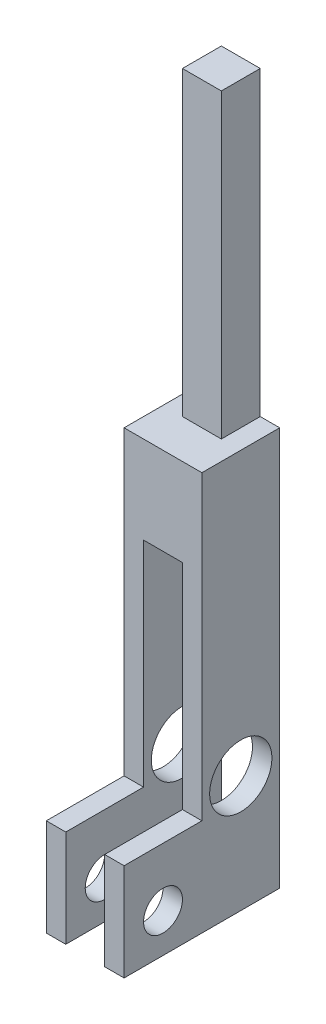
from build123d import *

# Parameters (mm, degrees)
SKETCH1_W           = 20
SKETCH1_H           = 40
BOSS_EXTRUDE1_DEPTH = 180
SKETCH2_W           = 20
SKETCH2_H           = 155
CUT_EXTRUDE1_DEPTH  = 29
SKETCH3_W           = 10
SKETCH3_H           = 77.5
CUT_EXTRUDE2_DEPTH  = 29
SKETCH4_W           = 10
SKETCH4_H           = 80
CUT_EXTRUDE3_DEPTH  = 49
SKETCH5_W           = 5
SKETCH5_H           = 77.5
CUT_EXTRUDE4_DEPTH  = 49
SKETCH6_W           = 5
SKETCH6_H           = 77.5
CUT_EXTRUDE5_DEPTH  = 49
SKETCH7_R           = 5
CUT_EXTRUDE6_DEPTH  = 49
SKETCH8_R           = 8
CUT_EXTRUDE7_DEPTH  = 49


with BuildPart() as part:
    # Sketch1 → Boss-Extrude1 (new body)
    with BuildSketch(Plane(origin=(0, 0, 0), x_dir=(1, 0, 0), z_dir=(0, 1, 0))):
        with Locations((10, 20)):
            Rectangle(SKETCH1_W, SKETCH1_H)
    extrude(amount=BOSS_EXTRUDE1_DEPTH)

    # Sketch2 → Cut-Extrude1 (cut)
    with BuildSketch(Plane.ZY):
        with Locations((-10, 102.5)):
            Rectangle(SKETCH2_W, SKETCH2_H)
    extrude(amount=-CUT_EXTRUDE1_DEPTH, mode=Mode.SUBTRACT)

    # Sketch3 → Cut-Extrude2 (cut)
    with BuildSketch(Plane.ZY):
        with Locations((-25, 141.25)):
            Rectangle(SKETCH3_W, SKETCH3_H)
    extrude(amount=-CUT_EXTRUDE2_DEPTH, mode=Mode.SUBTRACT)

    # Sketch4 → Cut-Extrude3 (cut)
    with BuildSketch(Plane(origin=(0, 0, -40), x_dir=(-1, 0, 0), z_dir=(0, 0, -1))):
        with Locations((-10, 40)):
            Rectangle(SKETCH4_W, SKETCH4_H)
    extrude(amount=-CUT_EXTRUDE3_DEPTH, mode=Mode.SUBTRACT)

    # Sketch5 → Cut-Extrude4 (cut)
    with BuildSketch(Plane.XY.offset(-30)):
        with Locations((2.5, 141.25)):
            Rectangle(SKETCH5_W, SKETCH5_H)
    extrude(amount=-CUT_EXTRUDE4_DEPTH, mode=Mode.SUBTRACT)

    # Sketch6 → Cut-Extrude5 (cut)
    with BuildSketch(Plane.XY.offset(-30)):
        with Locations((17.5, 141.25)):
            Rectangle(SKETCH6_W, SKETCH6_H)
    extrude(amount=-CUT_EXTRUDE5_DEPTH, mode=Mode.SUBTRACT)

    # Sketch7 → Cut-Extrude6 (cut)
    with BuildSketch(Plane(origin=(20, 0, 0), x_dir=(0, 0, -1), z_dir=(1, 0, 0))):
        with Locations((10, 10)):
            Circle(SKETCH7_R)
    extrude(amount=-CUT_EXTRUDE6_DEPTH, mode=Mode.SUBTRACT)

    # Sketch8 → Cut-Extrude7 (cut)
    with BuildSketch(Plane(origin=(20, 0, 0), x_dir=(0, 0, -1), z_dir=(1, 0, 0))):
        with Locations((30, 30)):
            Circle(SKETCH8_R)
    extrude(amount=-CUT_EXTRUDE7_DEPTH, mode=Mode.SUBTRACT)


solid = part.part
